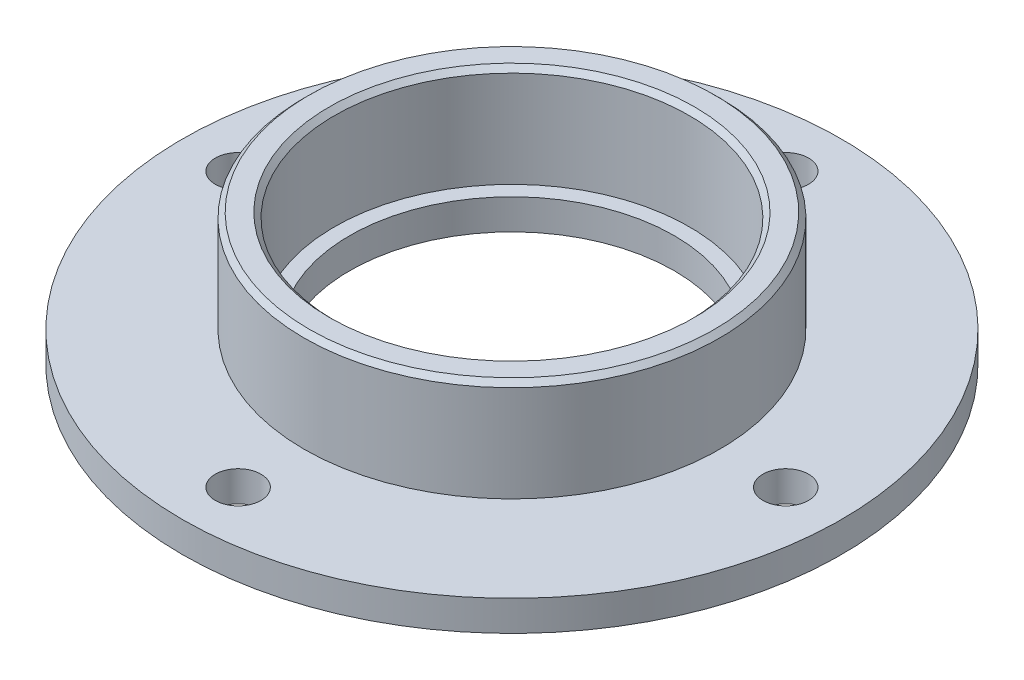
from build123d import *

# Parameters (mm, degrees)
SKETCH1_R                = 32.5
SKETCH1_R_2              = 16
SKETCH1_R_3              = 1
BOSS_EXTRUDE1_DEPTH      = 3
SKETCH2_R                = 20.5
SKETCH2_R_2              = 17.5
BOSS_EXTRUDE2_DEPTH      = 10
M4_CLEARANCE_HOLE2_D     = 4.5
M4_CLEARANCE_HOLE2_DEPTH = 11.5
M4_CLEARANCE_HOLE2_TIP   = 1.351936393
CHAMFER1_SIZE            = 0.5


with BuildPart() as part:
    # Sketch1 → Boss-Extrude1 (new body)
    with BuildSketch(Plane(origin=(0, 0, 0), x_dir=(1, 0, 0), z_dir=(0, 1, 0))):
        with Locations(Location((0, 0, 0), (0, 0, 270))):
            Circle(SKETCH1_R)
        with Locations(Location((0, 0, 0), (0, 0, 270))):
            Circle(SKETCH1_R_2, mode=Mode.SUBTRACT)
        with Locations(Location((0, 27, 0), (0, 0, 270))):
            Circle(SKETCH1_R_3, mode=Mode.SUBTRACT)
        with Locations(Location((27, 0, 0), (0, 0, 270))):
            Circle(SKETCH1_R_3, mode=Mode.SUBTRACT)
        with Locations(Location((0, -27, 0), (0, 0, 270))):
            Circle(SKETCH1_R_3, mode=Mode.SUBTRACT)
        with Locations(Location((-27, 0, 0), (0, 0, 270))):
            Circle(SKETCH1_R_3, mode=Mode.SUBTRACT)
    extrude(amount=BOSS_EXTRUDE1_DEPTH)

    # Sketch2 → Boss-Extrude2 (add)
    with BuildSketch(Plane(origin=(0, 3, 0), x_dir=(1, 0, 0), z_dir=(0, 1, 0))):
        with Locations(Location((0, 0, 0), (0, 0, 270))):
            Circle(SKETCH2_R)
        with Locations(Location((0, 0, 0), (0, 0, 270))):
            Circle(SKETCH2_R_2, mode=Mode.SUBTRACT)
    extrude(amount=BOSS_EXTRUDE2_DEPTH)

    # M4 Clearance Hole2
    with Locations(Plane(origin=(0, 3, 0), x_dir=(1, 0, 0), z_dir=(0, 1, 0))):
        with Locations((0, 27), (27, 0), (0, -27), (-27, 0)):
            Hole(M4_CLEARANCE_HOLE2_D / 2, depth=M4_CLEARANCE_HOLE2_DEPTH)
            with Locations((0, 0, -(M4_CLEARANCE_HOLE2_DEPTH + M4_CLEARANCE_HOLE2_TIP / 2))):  # 118° drill point
                Cone(0, M4_CLEARANCE_HOLE2_D / 2, M4_CLEARANCE_HOLE2_TIP, mode=Mode.SUBTRACT)

    # Chamfer1
    chamfer1_edges = [part.edges().sort_by_distance(p)[0] for p in [
        (0, 13, -20.5),
        (0, 13, -17.5),
    ]]
    chamfer(chamfer1_edges, length=CHAMFER1_SIZE)


solid = part.part
